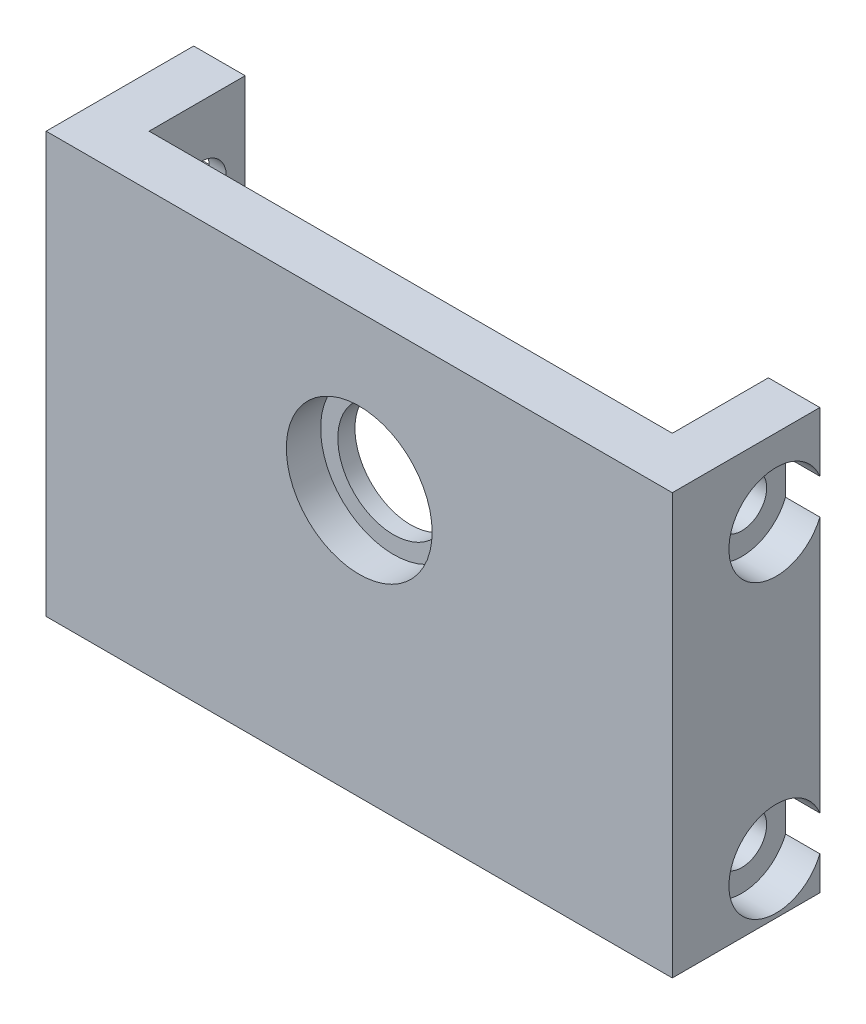
from build123d import *

# Parameters (mm, degrees)
RESSALTO_EXTRUS_O1_START         = 0.25
ESBO_O2_W                        = 30.5
ESBO_O2_H                        = 24.5
RESSALTO_EXTRUS_O1_DEPTH         = 3
ESBO_O3_W                        = 8.6
ESBO_O3_H                        = 24.5
RESSALTO_EXTRUS_O2_DEPTH         = 3
ESBO_O5_R                        = 4.25
CORTE_EXTRUS_O1_DEPTH            = 2
ESBO_O12_R                       = 3.25
CORTE_EXTRUS_O3_DEPTH            = 41.141904539
CBORE_FOR_M2_5_SHCS1_D           = 2.9
CBORE_FOR_M2_5_SHCS1_DEPTH       = 3
CBORE_FOR_M2_5_SHCS1_CBORE_D     = 5.5
CBORE_FOR_M2_5_SHCS1_CBORE_DEPTH = 2


with BuildPart() as part:
    # Esboço2 → Ressalto-extrusão1 (new body)
    with BuildSketch(Plane.XY.offset(RESSALTO_EXTRUS_O1_START)):
        with Locations((15, -9.25)):
            Rectangle(ESBO_O2_W, ESBO_O2_H)
    extrude(amount=RESSALTO_EXTRUS_O1_DEPTH)

    # Esboço3 → Ressalto-extrusão2 (add)
    with BuildSketch(Plane.ZY.offset(0.25)):
        with Locations((-1.05, -9.25)):
            Rectangle(ESBO_O3_W, ESBO_O3_H)
    ressalto_extrus_o2 = extrude(amount=RESSALTO_EXTRUS_O2_DEPTH)

    # Espelhar1: Ressalto-extrusão2 across plane
    add(ressalto_extrus_o2.mirror(Plane.ZY.offset(-15)))

    # Esboço5 → Corte-extrusão1 (cut)
    with BuildSketch(Plane.XY.offset(3.25)):
        with Locations((15, -6)):
            Circle(ESBO_O5_R)
    extrude(amount=-CORTE_EXTRUS_O1_DEPTH, mode=Mode.SUBTRACT)

    # Esboço12 → Corte-extrusão3 (cut, through all)
    with BuildSketch(Plane.XY.offset(1.25)):
        with Locations((15, -6)):
            Circle(ESBO_O12_R)
    extrude(amount=-CORTE_EXTRUS_O3_DEPTH, mode=Mode.SUBTRACT)

    # CBORE for M2.5 SHCS1
    with Locations(Plane.ZY.offset(3.25)):
        with Locations((-2.8, -1.5), (-2.8, -18.5)):
            cbore_for_m2_5_shcs1 = CounterBoreHole(CBORE_FOR_M2_5_SHCS1_D / 2, CBORE_FOR_M2_5_SHCS1_CBORE_D / 2, CBORE_FOR_M2_5_SHCS1_CBORE_DEPTH, depth=CBORE_FOR_M2_5_SHCS1_DEPTH)

    # Mirror1: CBORE for M2.5 SHCS1 across plane
    add(cbore_for_m2_5_shcs1.mirror(Plane.ZY.offset(-15)), mode=Mode.SUBTRACT)


solid = part.part
